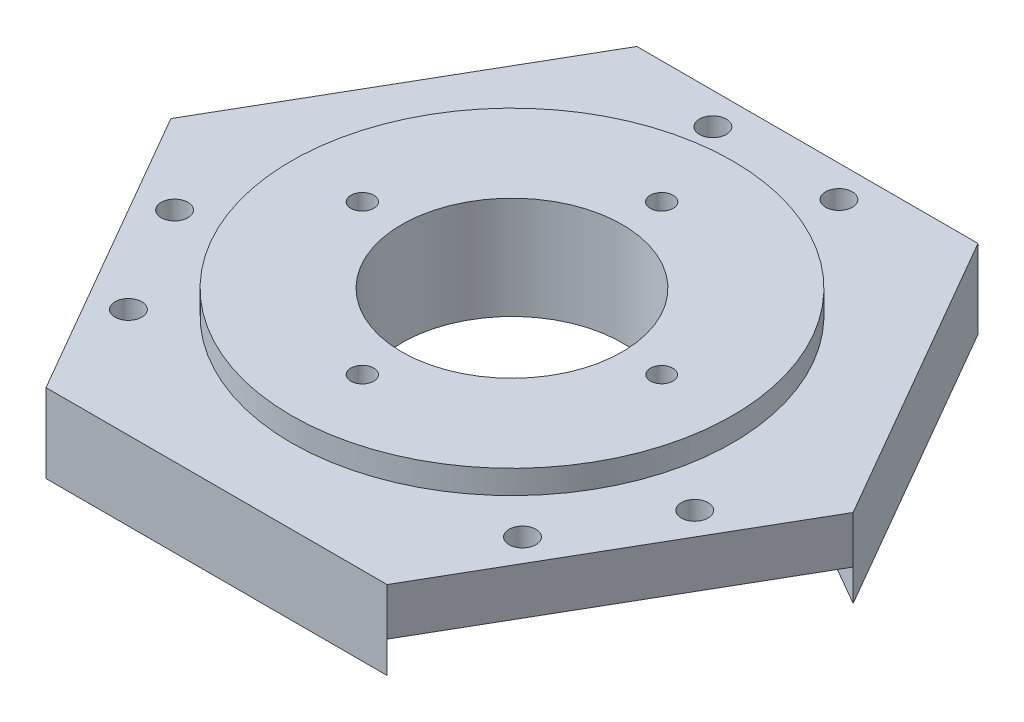
from build123d import *

# Parameters (mm, degrees)
EXTRUDE_1_DEPTH          = 10
SKETCH_2_R               = 1.45
SKETCH_2_R_2             = 14
CUT_EXTRUDE_1_DEPTH      = 10
CUT_EXTRUDE_START        = -7
SKETCH_4_R               = 3.2
SKETCH_4_R_2             = 1.45
CUT_EXTRUDE_2_DEPTH      = 7
SKETCH_4_3_W             = 43.30127019
SKETCH_4_3_H             = 7
CUT_EXTRUDE_3_DEPTH      = 4
SKETCH_4_4_R             = 1.7
CUT_EXTRUDE_4_DEPTH      = 41
EXTRUDE_START            = 3
SKETCH_5_R               = 28
SKETCH_5_R_2             = 14
SKETCH_5_R_3             = 1.426889677
SKETCH_5_R_4             = 1.45
EXTRUDE_2_DEPTH          = 3
PATTERN_CIRCULAR_1_COUNT = 3


with BuildPart() as part:
    # 草图1 → 凸台-拉伸1 (new body)
    with BuildSketch(Plane(origin=(0, 0, 0), x_dir=(1, 0, 0), z_dir=(0, 1, 0))):
        Polygon((43.301270189, 0), (21.650635095, 37.5), (-21.650635095, 37.5), (-43.301270189, 0), (-21.650635095, -37.5), (21.650635095, -37.5), align=None)
    extrude(amount=EXTRUDE_1_DEPTH)

    # 草图2 → 切除-拉伸1 (cut)
    with BuildSketch(Plane(origin=(0, 10, 0), x_dir=(1, 0, 0), z_dir=(0, 1, 0))):
        with Locations((0, 19)):
            Circle(SKETCH_2_R)
        with Locations((19, 0)):
            Circle(SKETCH_2_R)
        with Locations((0, -19)):
            Circle(SKETCH_2_R)
        with Locations((-19, 0)):
            Circle(SKETCH_2_R)
        Circle(SKETCH_2_R_2)
    extrude(amount=-CUT_EXTRUDE_1_DEPTH, mode=Mode.SUBTRACT)

    # 草图4 → 切除-拉伸2 (cut)
    # profile 1 of 4: a face of its own
    with BuildSketch(Plane.XZ.offset(CUT_EXTRUDE_START)):
        with Locations((-19, 0)):
            Circle(SKETCH_4_R)
        with Locations((-19, 0)):
            Circle(SKETCH_4_R_2, mode=Mode.SUBTRACT)
    # profile 2 of 4: a face of its own
    with BuildSketch(Plane.XZ.offset(CUT_EXTRUDE_START)):
        with Locations((0, -19)):
            Circle(SKETCH_4_R)
    # profile 3 of 4: a face of its own
    with BuildSketch(Plane.XZ.offset(CUT_EXTRUDE_START)):
        with Locations((19, 0)):
            Circle(SKETCH_4_R)
        with Locations((19, 0)):
            Circle(SKETCH_4_R_2, mode=Mode.SUBTRACT)
    # profile 4 of 4: a face of its own
    with BuildSketch(Plane.XZ.offset(CUT_EXTRUDE_START)):
        with Locations((0, 19)):
            Circle(SKETCH_4_R)
        with Locations((0, 19)):
            Circle(SKETCH_4_R_2, mode=Mode.SUBTRACT)
    extrude(amount=CUT_EXTRUDE_2_DEPTH, mode=Mode.SUBTRACT)

    # 草图4<3> → 切除-拉伸3 (cut)
    with BuildSketch(Plane.XZ):
        with Locations((0, -34)):
            Rectangle(SKETCH_4_3_W, SKETCH_4_3_H)
    cut_extrude_3 = extrude(amount=-CUT_EXTRUDE_3_DEPTH, mode=Mode.SUBTRACT)

    # 草图4<4> → 切除-拉伸4 (cut)
    with BuildSketch(Plane.XZ):
        with Locations((8, -33.5)):
            Circle(SKETCH_4_4_R)
        with Locations((-8, -33.5)):
            Circle(SKETCH_4_4_R)
    cut_extrude_4 = extrude(amount=-CUT_EXTRUDE_4_DEPTH, mode=Mode.SUBTRACT)

    # 草图5 → 凸台-拉伸2 (add)
    with BuildSketch(Plane(origin=(0, 10, 0), x_dir=(1, 0, 0), z_dir=(0, 1, 0)).offset(EXTRUDE_START)):
        Circle(SKETCH_5_R)
        Circle(SKETCH_5_R_2, mode=Mode.SUBTRACT)
        with Locations((19, 0)):
            Circle(SKETCH_5_R_3, mode=Mode.SUBTRACT)
        with Locations((0, 19)):
            Circle(SKETCH_5_R_4, mode=Mode.SUBTRACT)
        with Locations((-19, 0)):
            Circle(SKETCH_5_R_4, mode=Mode.SUBTRACT)
        with Locations((0, -19)):
            Circle(SKETCH_5_R_4, mode=Mode.SUBTRACT)
    extrude(amount=-EXTRUDE_2_DEPTH)

    # 阵列(圆周)1: 切除-拉伸3, 切除-拉伸4 ×3 about axis
    pattern_circular_1_axis = Axis((0, 0, 0), (0, 1, 0))
    add([cut_extrude_3.rotate(pattern_circular_1_axis, i * 360 / PATTERN_CIRCULAR_1_COUNT) for i in range(1, PATTERN_CIRCULAR_1_COUNT)], mode=Mode.SUBTRACT)
    add([cut_extrude_4.rotate(pattern_circular_1_axis, i * 360 / PATTERN_CIRCULAR_1_COUNT) for i in range(1, PATTERN_CIRCULAR_1_COUNT)], mode=Mode.SUBTRACT)


solid = part.part
